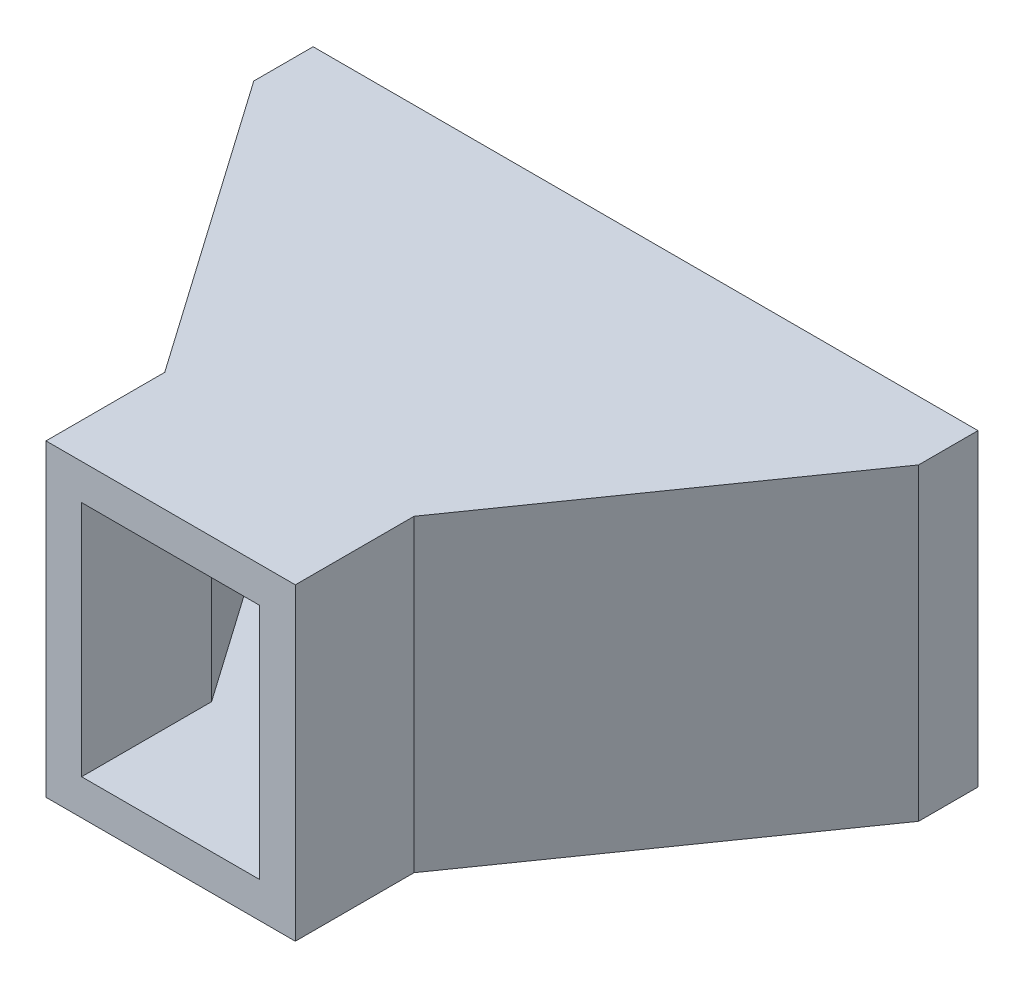
from build123d import *

# Parameters (mm, degrees)
SALIENTE_EXTRUIR1_DEPTH   = 20
SALIENTE_EXTRUIR1_2_DEPTH = 20
SALIENTE_EXTRUIR2_DEPTH   = 3
SALIENTE_EXTRUIR3_START   = -20
SALIENTE_EXTRUIR3_DEPTH   = 3


with BuildPart() as part:
    # Croquis1 → Saliente-Extruir1 (new body)
    with BuildSketch(Plane(origin=(0, 0, 0), x_dir=(1, 0, 0), z_dir=(0, 1, 0))):
        Polygon((-25, 17.391304348), (-25, 13.33697104), (-7.5, -11.66302896), (-7.5, -22.608695652), (-10.5, -22.608695652), (-10.5, -12.608695652), (-28, 12.391304348), (-28, 17.391304348), align=None)
    extrude(amount=SALIENTE_EXTRUIR1_DEPTH)



with BuildPart() as body_2:
    # Croquis1 → Saliente-Extruir1 2 (new body)
    with BuildSketch(Plane(origin=(0, 0, 0), x_dir=(1, 0, 0), z_dir=(0, 1, 0))):
        Polygon((7.5, -11.66302896), (7.5, -22.608695652), (10.5, -22.608695652), (10.5, -12.608695652), (28, 12.391304348), (28, 17.391304348), (25, 17.391304348), (25, 13.33697104), align=None)
    extrude(amount=SALIENTE_EXTRUIR1_2_DEPTH)


with BuildPart() as part_1:
    add(part.part)

    add(body_2.part)  # Saliente-Extruir2 merges body 2
    # Croquis2 → Saliente-Extruir2 (add)
    with BuildSketch(Plane(origin=(0, 20, 0), x_dir=(1, 0, 0), z_dir=(0, 1, 0))):
        Polygon((-10.5, -22.608695652), (10.5, -22.608695652), (10.5, -12.608695652), (28, 12.391304348), (28, 17.391304348), (-28, 17.391304348), (-28, 12.391304348), (-10.5, -12.608695652), align=None)
    extrude(amount=SALIENTE_EXTRUIR2_DEPTH)

    # Croquis2<2> → Saliente-Extruir3 (add)
    with BuildSketch(Plane(origin=(0, 20, 0), x_dir=(1, 0, 0), z_dir=(0, 1, 0)).offset(SALIENTE_EXTRUIR3_START)):
        Polygon((-10.5, -22.608695652), (10.5, -22.608695652), (10.5, -12.608695652), (28, 12.391304348), (28, 17.391304348), (-28, 17.391304348), (-28, 12.391304348), (-10.5, -12.608695652), align=None)
    extrude(amount=-SALIENTE_EXTRUIR3_DEPTH)


solid = part_1.part
